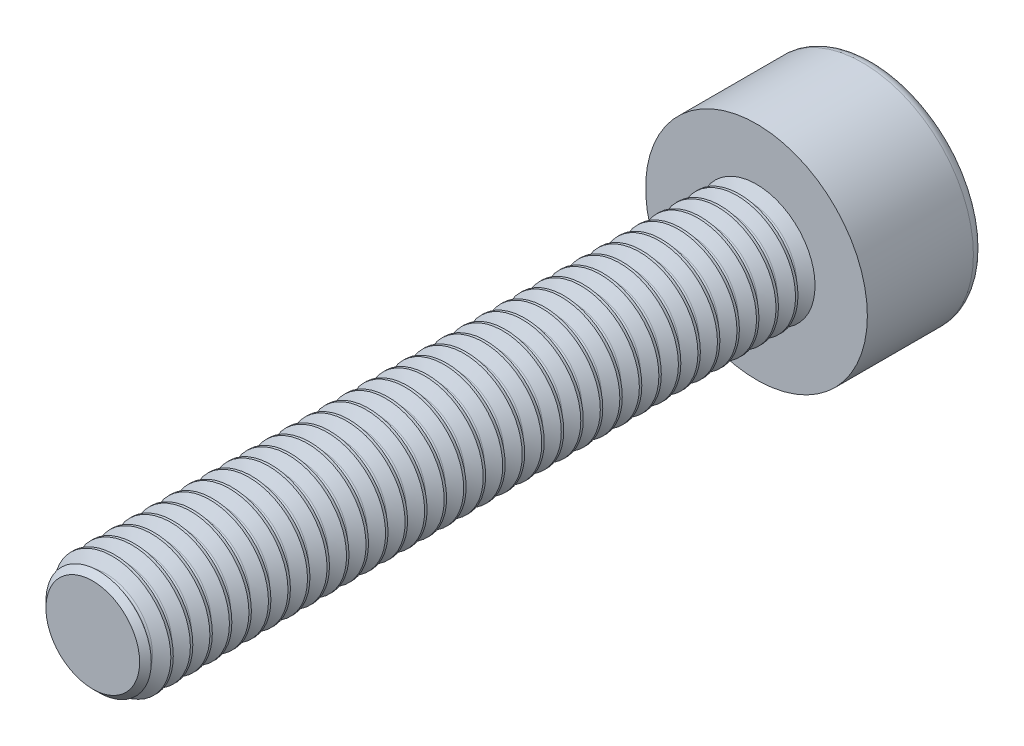
from build123d import *

# Parameters (mm, degrees)
CUT_EXTRUDE1_DEPTH = 1.5
FILLET1_R          = 0.284


with BuildPart() as part:
    # Sketch1 → Revolve1 (revolve)
    with BuildSketch(Plane.XZ):
        with BuildLine():
            Line((0, -3.000000001), (0, 16.999999999))
            Line((0, 16.999999999), (1.2, 16.999999999))
            Line((1.2, 16.999999999), (1.349431033, 16.850568966))
            Line((1.349431033, 16.850568966), (1.202303767, 16.765624999))
            add(Edge.make_bspline(
                [(1.202303767, 16.765624999), (1.186678767, 16.756603901), (1.175240473, 16.736792195), (1.175240473, 16.718749999)],
                knots=[0, 0, 0, 0, 1, 1, 1, 1], degree=3))
            add(Edge.make_bspline(
                [(1.175240473, 16.718749999), (1.175240473, 16.700707803), (1.186678767, 16.680896097), (1.202303767, 16.671875)],
                knots=[0, 0, 0, 0, 1, 1, 1, 1], degree=3))
            Line((1.202303767, 16.671875), (1.5, 16.5))
            Line((1.5, 16.5), (1.5, 16.4375))
            Line((1.5, 16.4375), (1.202303767, 16.265625))
            add(Edge.make_bspline(
                [(1.175240473, 16.21875), (1.175240473, 16.236792196), (1.186678767, 16.256603902), (1.202303767, 16.265625)],
                knots=[0, 0, 0, 0, 1, 1, 1, 1], degree=3))
            add(Edge.make_bspline(
                [(1.202303767, 16.171875), (1.186678767, 16.180896098), (1.175240473, 16.200707804), (1.175240473, 16.21875)],
                knots=[0, 0, 0, 0, 1, 1, 1, 1], degree=3))
            Line((1.202303767, 16.171875), (1.5, 16))
            Line((1.5, 16), (1.5, 15.9375))
            Line((1.5, 15.9375), (1.202303767, 15.765625))
            add(Edge.make_bspline(
                [(1.175240473, 15.71875), (1.175240473, 15.736792196), (1.186678767, 15.756603902), (1.202303767, 15.765625)],
                knots=[0, 0, 0, 0, 1, 1, 1, 1], degree=3))
            add(Edge.make_bspline(
                [(1.202303767, 15.671875), (1.186678767, 15.680896098), (1.175240473, 15.700707804), (1.175240473, 15.71875)],
                knots=[0, 0, 0, 0, 1, 1, 1, 1], degree=3))
            Line((1.202303767, 15.671875), (1.5, 15.5))
            Line((1.5, 15.5), (1.5, 15.4375))
            Line((1.5, 15.4375), (1.202303767, 15.265625))
            add(Edge.make_bspline(
                [(1.175240473, 15.21875), (1.175240473, 15.236792196), (1.186678767, 15.256603902), (1.202303767, 15.265625)],
                knots=[0, 0, 0, 0, 1, 1, 1, 1], degree=3))
            add(Edge.make_bspline(
                [(1.202303767, 15.171875), (1.186678767, 15.180896098), (1.175240473, 15.200707804), (1.175240473, 15.21875)],
                knots=[0, 0, 0, 0, 1, 1, 1, 1], degree=3))
            Line((1.202303767, 15.171875), (1.5, 15))
            Line((1.5, 15), (1.5, 14.9375))
            Line((1.5, 14.9375), (1.202303767, 14.765625))
            add(Edge.make_bspline(
                [(1.175240473, 14.71875), (1.175240473, 14.736792196), (1.186678767, 14.756603902), (1.202303767, 14.765625)],
                knots=[0, 0, 0, 0, 1, 1, 1, 1], degree=3))
            add(Edge.make_bspline(
                [(1.202303767, 14.671875), (1.186678767, 14.680896098), (1.175240473, 14.700707804), (1.175240473, 14.71875)],
                knots=[0, 0, 0, 0, 1, 1, 1, 1], degree=3))
            Line((1.202303767, 14.671875), (1.5, 14.5))
            Line((1.5, 14.5), (1.5, 14.4375))
            Line((1.5, 14.4375), (1.202303767, 14.265625))
            add(Edge.make_bspline(
                [(1.175240473, 14.21875), (1.175240473, 14.236792196), (1.186678767, 14.256603902), (1.202303767, 14.265625)],
                knots=[0, 0, 0, 0, 1, 1, 1, 1], degree=3))
            add(Edge.make_bspline(
                [(1.202303767, 14.171875), (1.186678767, 14.180896098), (1.175240473, 14.200707804), (1.175240473, 14.21875)],
                knots=[0, 0, 0, 0, 1, 1, 1, 1], degree=3))
            Line((1.202303767, 14.171875), (1.5, 14))
            Line((1.5, 14), (1.5, 13.9375))
            Line((1.5, 13.9375), (1.202303767, 13.765625))
            add(Edge.make_bspline(
                [(1.175240473, 13.71875), (1.175240473, 13.736792196), (1.186678767, 13.756603902), (1.202303767, 13.765625)],
                knots=[0, 0, 0, 0, 1, 1, 1, 1], degree=3))
            add(Edge.make_bspline(
                [(1.202303767, 13.671875), (1.186678767, 13.680896098), (1.175240473, 13.700707804), (1.175240473, 13.71875)],
                knots=[0, 0, 0, 0, 1, 1, 1, 1], degree=3))
            Line((1.202303767, 13.671875), (1.5, 13.5))
            Line((1.5, 13.5), (1.5, 13.4375))
            Line((1.5, 13.4375), (1.202303767, 13.265625))
            add(Edge.make_bspline(
                [(1.175240473, 13.21875), (1.175240473, 13.236792196), (1.186678767, 13.256603902), (1.202303767, 13.265625)],
                knots=[0, 0, 0, 0, 1, 1, 1, 1], degree=3))
            add(Edge.make_bspline(
                [(1.202303767, 13.171875), (1.186678767, 13.180896098), (1.175240473, 13.200707804), (1.175240473, 13.21875)],
                knots=[0, 0, 0, 0, 1, 1, 1, 1], degree=3))
            Line((1.202303767, 13.171875), (1.5, 13))
            Line((1.5, 13), (1.5, 12.9375))
            Line((1.5, 12.9375), (1.202303767, 12.765625))
            add(Edge.make_bspline(
                [(1.175240473, 12.71875), (1.175240473, 12.736792196), (1.186678767, 12.756603902), (1.202303767, 12.765625)],
                knots=[0, 0, 0, 0, 1, 1, 1, 1], degree=3))
            add(Edge.make_bspline(
                [(1.202303767, 12.671875), (1.186678767, 12.680896098), (1.175240473, 12.700707804), (1.175240473, 12.71875)],
                knots=[0, 0, 0, 0, 1, 1, 1, 1], degree=3))
            Line((1.202303767, 12.671875), (1.5, 12.5))
            Line((1.5, 12.5), (1.5, 12.4375))
            Line((1.5, 12.4375), (1.202303767, 12.265625))
            add(Edge.make_bspline(
                [(1.175240473, 12.21875), (1.175240473, 12.236792196), (1.186678767, 12.256603902), (1.202303767, 12.265625)],
                knots=[0, 0, 0, 0, 1, 1, 1, 1], degree=3))
            add(Edge.make_bspline(
                [(1.202303767, 12.171875), (1.186678767, 12.180896098), (1.175240473, 12.200707804), (1.175240473, 12.21875)],
                knots=[0, 0, 0, 0, 1, 1, 1, 1], degree=3))
            Line((1.202303767, 12.171875), (1.5, 12))
            Line((1.5, 12), (1.5, 11.9375))
            Line((1.5, 11.9375), (1.202303767, 11.765625))
            add(Edge.make_bspline(
                [(1.175240473, 11.71875), (1.175240473, 11.736792196), (1.186678767, 11.756603902), (1.202303767, 11.765625)],
                knots=[0, 0, 0, 0, 1, 1, 1, 1], degree=3))
            add(Edge.make_bspline(
                [(1.202303767, 11.671875), (1.186678767, 11.680896098), (1.175240473, 11.700707804), (1.175240473, 11.71875)],
                knots=[0, 0, 0, 0, 1, 1, 1, 1], degree=3))
            Line((1.202303767, 11.671875), (1.5, 11.5))
            Line((1.5, 11.5), (1.5, 11.4375))
            Line((1.5, 11.4375), (1.202303767, 11.265625))
            add(Edge.make_bspline(
                [(1.175240473, 11.21875), (1.175240473, 11.236792196), (1.186678767, 11.256603902), (1.202303767, 11.265625)],
                knots=[0, 0, 0, 0, 1, 1, 1, 1], degree=3))
            add(Edge.make_bspline(
                [(1.202303767, 11.171875), (1.186678767, 11.180896098), (1.175240473, 11.200707804), (1.175240473, 11.21875)],
                knots=[0, 0, 0, 0, 1, 1, 1, 1], degree=3))
            Line((1.202303767, 11.171875), (1.5, 11))
            Line((1.5, 11), (1.5, 10.9375))
            Line((1.5, 10.9375), (1.202303767, 10.765625))
            add(Edge.make_bspline(
                [(1.175240473, 10.71875), (1.175240473, 10.736792196), (1.186678767, 10.756603902), (1.202303767, 10.765625)],
                knots=[0, 0, 0, 0, 1, 1, 1, 1], degree=3))
            add(Edge.make_bspline(
                [(1.202303767, 10.671875), (1.186678767, 10.680896098), (1.175240473, 10.700707804), (1.175240473, 10.71875)],
                knots=[0, 0, 0, 0, 1, 1, 1, 1], degree=3))
            Line((1.202303767, 10.671875), (1.5, 10.5))
            Line((1.5, 10.5), (1.5, 10.4375))
            Line((1.5, 10.4375), (1.202303767, 10.265625))
            add(Edge.make_bspline(
                [(1.175240473, 10.21875), (1.175240473, 10.236792196), (1.186678767, 10.256603902), (1.202303767, 10.265625)],
                knots=[0, 0, 0, 0, 1, 1, 1, 1], degree=3))
            add(Edge.make_bspline(
                [(1.202303767, 10.171875), (1.186678767, 10.180896098), (1.175240473, 10.200707804), (1.175240473, 10.21875)],
                knots=[0, 0, 0, 0, 1, 1, 1, 1], degree=3))
            Line((1.202303767, 10.171875), (1.5, 10))
            Line((1.5, 10), (1.5, 9.9375))
            Line((1.5, 9.9375), (1.202303767, 9.765625))
            add(Edge.make_bspline(
                [(1.175240473, 9.71875), (1.175240473, 9.736792196), (1.186678767, 9.756603902), (1.202303767, 9.765625)],
                knots=[0, 0, 0, 0, 1, 1, 1, 1], degree=3))
            add(Edge.make_bspline(
                [(1.202303767, 9.671875), (1.186678767, 9.680896098), (1.175240473, 9.700707804), (1.175240473, 9.71875)],
                knots=[0, 0, 0, 0, 1, 1, 1, 1], degree=3))
            Line((1.202303767, 9.671875), (1.5, 9.5))
            Line((1.5, 9.5), (1.5, 9.4375))
            Line((1.5, 9.4375), (1.202303767, 9.265625))
            add(Edge.make_bspline(
                [(1.175240473, 9.21875), (1.175240473, 9.236792196), (1.186678767, 9.256603902), (1.202303767, 9.265625)],
                knots=[0, 0, 0, 0, 1, 1, 1, 1], degree=3))
            add(Edge.make_bspline(
                [(1.202303767, 9.171875), (1.186678767, 9.180896098), (1.175240473, 9.200707804), (1.175240473, 9.21875)],
                knots=[0, 0, 0, 0, 1, 1, 1, 1], degree=3))
            Line((1.202303767, 9.171875), (1.5, 9))
            Line((1.5, 9), (1.5, 8.9375))
            Line((1.5, 8.9375), (1.202303767, 8.765625))
            add(Edge.make_bspline(
                [(1.175240473, 8.71875), (1.175240473, 8.736792196), (1.186678767, 8.756603902), (1.202303767, 8.765625)],
                knots=[0, 0, 0, 0, 1, 1, 1, 1], degree=3))
            add(Edge.make_bspline(
                [(1.202303767, 8.671875), (1.186678767, 8.680896098), (1.175240473, 8.700707804), (1.175240473, 8.71875)],
                knots=[0, 0, 0, 0, 1, 1, 1, 1], degree=3))
            Line((1.202303767, 8.671875), (1.5, 8.5))
            Line((1.5, 8.5), (1.5, 8.4375))
            Line((1.5, 8.4375), (1.202303767, 8.265625))
            add(Edge.make_bspline(
                [(1.175240473, 8.21875), (1.175240473, 8.236792196), (1.186678767, 8.256603902), (1.202303767, 8.265625)],
                knots=[0, 0, 0, 0, 1, 1, 1, 1], degree=3))
            add(Edge.make_bspline(
                [(1.202303767, 8.171875), (1.186678767, 8.180896098), (1.175240473, 8.200707804), (1.175240473, 8.21875)],
                knots=[0, 0, 0, 0, 1, 1, 1, 1], degree=3))
            Line((1.202303767, 8.171875), (1.5, 8))
            Line((1.5, 8), (1.5, 7.9375))
            Line((1.5, 7.9375), (1.202303767, 7.765625))
            add(Edge.make_bspline(
                [(1.175240473, 7.71875), (1.175240473, 7.736792196), (1.186678767, 7.756603902), (1.202303767, 7.765625)],
                knots=[0, 0, 0, 0, 1, 1, 1, 1], degree=3))
            add(Edge.make_bspline(
                [(1.202303767, 7.671875), (1.186678767, 7.680896098), (1.175240473, 7.700707804), (1.175240473, 7.71875)],
                knots=[0, 0, 0, 0, 1, 1, 1, 1], degree=3))
            Line((1.202303767, 7.671875), (1.5, 7.5))
            Line((1.5, 7.5), (1.5, 7.4375))
            Line((1.5, 7.4375), (1.202303767, 7.265625))
            add(Edge.make_bspline(
                [(1.175240473, 7.21875), (1.175240473, 7.236792196), (1.186678767, 7.256603902), (1.202303767, 7.265625)],
                knots=[0, 0, 0, 0, 1, 1, 1, 1], degree=3))
            add(Edge.make_bspline(
                [(1.202303767, 7.171875), (1.186678767, 7.180896098), (1.175240473, 7.200707804), (1.175240473, 7.21875)],
                knots=[0, 0, 0, 0, 1, 1, 1, 1], degree=3))
            Line((1.202303767, 7.171875), (1.5, 7))
            Line((1.5, 7), (1.5, 6.9375))
            Line((1.5, 6.9375), (1.202303767, 6.765625))
            add(Edge.make_bspline(
                [(1.175240473, 6.71875), (1.175240473, 6.736792196), (1.186678767, 6.756603902), (1.202303767, 6.765625)],
                knots=[0, 0, 0, 0, 1, 1, 1, 1], degree=3))
            add(Edge.make_bspline(
                [(1.202303767, 6.671875), (1.186678767, 6.680896098), (1.175240473, 6.700707804), (1.175240473, 6.71875)],
                knots=[0, 0, 0, 0, 1, 1, 1, 1], degree=3))
            Line((1.202303767, 6.671875), (1.5, 6.5))
            Line((1.5, 6.5), (1.5, 6.4375))
            Line((1.5, 6.4375), (1.202303767, 6.265625))
            add(Edge.make_bspline(
                [(1.175240473, 6.21875), (1.175240473, 6.236792196), (1.186678767, 6.256603902), (1.202303767, 6.265625)],
                knots=[0, 0, 0, 0, 1, 1, 1, 1], degree=3))
            add(Edge.make_bspline(
                [(1.202303767, 6.171875), (1.186678767, 6.180896098), (1.175240473, 6.200707804), (1.175240473, 6.21875)],
                knots=[0, 0, 0, 0, 1, 1, 1, 1], degree=3))
            Line((1.202303767, 6.171875), (1.5, 6))
            Line((1.5, 6), (1.5, 5.9375))
            Line((1.5, 5.9375), (1.202303767, 5.765625))
            add(Edge.make_bspline(
                [(1.175240473, 5.71875), (1.175240473, 5.736792196), (1.186678767, 5.756603902), (1.202303767, 5.765625)],
                knots=[0, 0, 0, 0, 1, 1, 1, 1], degree=3))
            add(Edge.make_bspline(
                [(1.202303767, 5.671875), (1.186678767, 5.680896098), (1.175240473, 5.700707804), (1.175240473, 5.71875)],
                knots=[0, 0, 0, 0, 1, 1, 1, 1], degree=3))
            Line((1.202303767, 5.671875), (1.5, 5.5))
            Line((1.5, 5.5), (1.5, 5.4375))
            Line((1.5, 5.4375), (1.202303767, 5.265625))
            add(Edge.make_bspline(
                [(1.175240473, 5.21875), (1.175240473, 5.236792196), (1.186678767, 5.256603902), (1.202303767, 5.265625)],
                knots=[0, 0, 0, 0, 1, 1, 1, 1], degree=3))
            add(Edge.make_bspline(
                [(1.202303767, 5.171875), (1.186678767, 5.180896098), (1.175240473, 5.200707804), (1.175240473, 5.21875)],
                knots=[0, 0, 0, 0, 1, 1, 1, 1], degree=3))
            Line((1.202303767, 5.171875), (1.5, 5))
            Line((1.5, 5), (1.5, 4.9375))
            Line((1.5, 4.9375), (1.202303767, 4.765625))
            add(Edge.make_bspline(
                [(1.175240473, 4.71875), (1.175240473, 4.736792196), (1.186678767, 4.756603902), (1.202303767, 4.765625)],
                knots=[0, 0, 0, 0, 1, 1, 1, 1], degree=3))
            add(Edge.make_bspline(
                [(1.202303767, 4.671875), (1.186678767, 4.680896098), (1.175240473, 4.700707804), (1.175240473, 4.71875)],
                knots=[0, 0, 0, 0, 1, 1, 1, 1], degree=3))
            Line((1.202303767, 4.671875), (1.5, 4.5))
            Line((1.5, 4.5), (1.5, 4.4375))
            Line((1.5, 4.4375), (1.202303767, 4.265625))
            add(Edge.make_bspline(
                [(1.175240473, 4.21875), (1.175240473, 4.236792196), (1.186678767, 4.256603902), (1.202303767, 4.265625)],
                knots=[0, 0, 0, 0, 1, 1, 1, 1], degree=3))
            add(Edge.make_bspline(
                [(1.202303767, 4.171875), (1.186678767, 4.180896098), (1.175240473, 4.200707804), (1.175240473, 4.21875)],
                knots=[0, 0, 0, 0, 1, 1, 1, 1], degree=3))
            Line((1.202303767, 4.171875), (1.5, 4))
            Line((1.5, 4), (1.5, 3.9375))
            Line((1.5, 3.9375), (1.202303767, 3.765625))
            add(Edge.make_bspline(
                [(1.175240473, 3.71875), (1.175240473, 3.736792196), (1.186678767, 3.756603902), (1.202303767, 3.765625)],
                knots=[0, 0, 0, 0, 1, 1, 1, 1], degree=3))
            add(Edge.make_bspline(
                [(1.202303767, 3.671875), (1.186678767, 3.680896098), (1.175240473, 3.700707804), (1.175240473, 3.71875)],
                knots=[0, 0, 0, 0, 1, 1, 1, 1], degree=3))
            Line((1.202303767, 3.671875), (1.5, 3.5))
            Line((1.5, 3.5), (1.5, 3.4375))
            Line((1.5, 3.4375), (1.202303767, 3.265625))
            add(Edge.make_bspline(
                [(1.175240473, 3.21875), (1.175240473, 3.236792196), (1.186678767, 3.256603902), (1.202303767, 3.265625)],
                knots=[0, 0, 0, 0, 1, 1, 1, 1], degree=3))
            add(Edge.make_bspline(
                [(1.202303767, 3.171875), (1.186678767, 3.180896098), (1.175240473, 3.200707804), (1.175240473, 3.21875)],
                knots=[0, 0, 0, 0, 1, 1, 1, 1], degree=3))
            Line((1.202303767, 3.171875), (1.5, 3))
            Line((1.5, 3), (1.5, 2.9375))
            Line((1.5, 2.9375), (1.202303767, 2.765625))
            add(Edge.make_bspline(
                [(1.175240473, 2.71875), (1.175240473, 2.736792196), (1.186678767, 2.756603902), (1.202303767, 2.765625)],
                knots=[0, 0, 0, 0, 1, 1, 1, 1], degree=3))
            add(Edge.make_bspline(
                [(1.202303767, 2.671875), (1.186678767, 2.680896098), (1.175240473, 2.700707804), (1.175240473, 2.71875)],
                knots=[0, 0, 0, 0, 1, 1, 1, 1], degree=3))
            Line((1.202303767, 2.671875), (1.5, 2.5))
            Line((1.5, 2.5), (1.5, 2.4375))
            Line((1.5, 2.4375), (1.202303767, 2.265625))
            add(Edge.make_bspline(
                [(1.175240473, 2.21875), (1.175240473, 2.236792196), (1.186678767, 2.256603902), (1.202303767, 2.265625)],
                knots=[0, 0, 0, 0, 1, 1, 1, 1], degree=3))
            add(Edge.make_bspline(
                [(1.202303767, 2.171875), (1.186678767, 2.180896098), (1.175240473, 2.200707804), (1.175240473, 2.21875)],
                knots=[0, 0, 0, 0, 1, 1, 1, 1], degree=3))
            Line((1.202303767, 2.171875), (1.5, 2))
            Line((1.5, 2), (1.5, 1.9375))
            Line((1.5, 1.9375), (1.202303767, 1.765625))
            add(Edge.make_bspline(
                [(1.175240473, 1.71875), (1.175240473, 1.736792196), (1.186678767, 1.756603902), (1.202303767, 1.765625)],
                knots=[0, 0, 0, 0, 1, 1, 1, 1], degree=3))
            add(Edge.make_bspline(
                [(1.202303767, 1.671875), (1.186678767, 1.680896098), (1.175240473, 1.700707804), (1.175240473, 1.71875)],
                knots=[0, 0, 0, 0, 1, 1, 1, 1], degree=3))
            Line((1.202303767, 1.671875), (1.5, 1.5))
            Line((1.5, 1.5), (1.5, 1.4375))
            Line((1.5, 1.4375), (1.202303767, 1.265625))
            add(Edge.make_bspline(
                [(1.175240473, 1.21875), (1.175240473, 1.236792196), (1.186678767, 1.256603902), (1.202303767, 1.265625)],
                knots=[0, 0, 0, 0, 1, 1, 1, 1], degree=3))
            add(Edge.make_bspline(
                [(1.202303767, 1.171875), (1.186678767, 1.180896098), (1.175240473, 1.200707804), (1.175240473, 1.21875)],
                knots=[0, 0, 0, 0, 1, 1, 1, 1], degree=3))
            Line((1.202303767, 1.171875), (1.5, 1))
            Line((1.5, 1), (1.5, 0.9375))
            Line((1.5, 0.9375), (1.202303767, 0.765625))
            add(Edge.make_bspline(
                [(1.175240473, 0.71875), (1.175240473, 0.736792196), (1.186678767, 0.756603902), (1.202303767, 0.765625)],
                knots=[0, 0, 0, 0, 1, 1, 1, 1], degree=3))
            add(Edge.make_bspline(
                [(1.202303767, 0.671875), (1.186678767, 0.680896098), (1.175240473, 0.700707804), (1.175240473, 0.71875)],
                knots=[0, 0, 0, 0, 1, 1, 1, 1], degree=3))
            Line((1.202303767, 0.671875), (1.5, 0.5))
            Line((1.5, 0.5), (1.5, 0.4375))
            Line((1.5, 0.4375), (1.202303767, 0.265625))
            add(Edge.make_bspline(
                [(1.202303767, 0.265625), (1.186678767, 0.256603902), (1.175240473, 0.236792196), (1.175240473, 0.21875)],
                knots=[0, 0, 0, 0, 1, 1, 1, 1], degree=3))
            add(Edge.make_bspline(
                [(1.175240473, 0.21875), (1.175240473, 0.200707804), (1.186678767, 0.180896098), (1.202303767, 0.171875)],
                knots=[0, 0, 0, 0, 1, 1, 1, 1], degree=3))
            Line((1.202303767, 0.171875), (1.5, 0))
            Line((1.5, 0), (2.84, 0))
            Line((2.84, 0), (2.84, -3.000000001))
            Line((2.84, -3.000000001), (0, -3.000000001))
        make_face()
    revolve(axis=Axis((0, 0, -3.000000001), (0, 0, 1)))

    # Sketch2 → Cut-Extrude1 (cut)
    with BuildSketch(Plane(origin=(0, 0, -3.000000001), x_dir=(-1, 0, 0), z_dir=(0, 0, -1))):
        Polygon((-1.443375673, 0), (-0.721687837, -1.25), (0.721687836, -1.25), (1.443375672, 0), (0.721687836, 1.25), (-0.721687837, 1.25), align=None)
    extrude(amount=-CUT_EXTRUDE1_DEPTH, mode=Mode.SUBTRACT)

    # Fillet1
    fillet1_edges = [part.edges().sort_by_distance(p)[0] for p in [
        (-2.84, 0, -3.000000001),
    ]]
    fillet(fillet1_edges, radius=FILLET1_R)


solid = part.part
